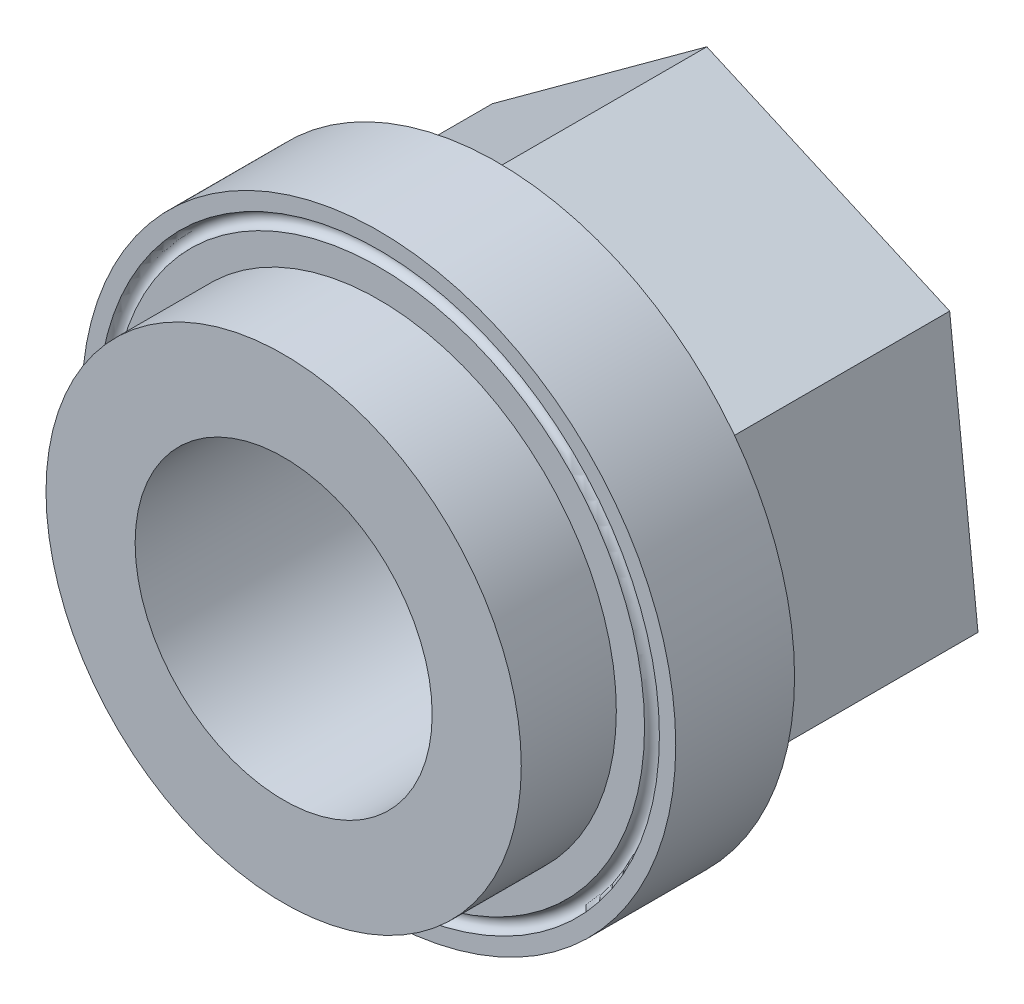
from build123d import *

# Parameters (mm, degrees)
SKETCH2_R            = 25
BOSS_EXTRUDE1_DEPTH  = 10
SKETCH3_R            = 20
BOSS_EXTRUDE2_DEPTH  = 8
BOSS_EXTRUDE3_DEPTH  = 20
SKETCH5_R            = 12.5
CUT_EXTRUDE1_DEPTH   = 52.903757089
CUT_SWEEP1_PROFILE_R = 0.625


with BuildPart() as part:
    # Sketch2 → Boss-Extrude1 (new body)
    with BuildSketch(Plane.XY):
        Circle(SKETCH2_R)
    extrude(amount=BOSS_EXTRUDE1_DEPTH)

    # Sketch3 → Boss-Extrude2 (add)
    with BuildSketch(Plane.XY.offset(10)):
        Circle(SKETCH3_R)
    extrude(amount=BOSS_EXTRUDE2_DEPTH)

    # Sketch4 → Boss-Extrude3 (add)
    with BuildSketch(Plane(origin=(0, 0, 0), x_dir=(-1, 0, 0), z_dir=(0, 0, -1))):
        Polygon((-20.437108974, -9.047000469), (-2.383622252, -22.222555786), (18.053486721, -13.175555316), (20.437108974, 9.047000469), (2.383622252, 22.222555786), (-18.053486721, 13.175555316), align=None)
    extrude(amount=BOSS_EXTRUDE3_DEPTH)

    # Sketch5 → Cut-Extrude1 (cut, through all)
    with BuildSketch(Plane(origin=(0, 0, -20), x_dir=(-1, 0, 0), z_dir=(0, 0, -1))):
        Circle(SKETCH5_R)
    extrude(amount=-CUT_EXTRUDE1_DEPTH, mode=Mode.SUBTRACT)

    # Cut-Sweep1: sweep along a path in Sketch6
    with BuildLine(Plane.XY.offset(10)) as cut_sweep1_path:
        CenterArc((0, 0), 23, 0, 360)
    # Cut-Sweep1 profile (on start of the path) → Cut-Sweep1 (sweep, cut)
    with BuildSketch(Plane(origin=(23, 0, 10), x_dir=(0, 0, 1), z_dir=(0, 1, 0))):
        Circle(CUT_SWEEP1_PROFILE_R)
    sweep(path=cut_sweep1_path.line, mode=Mode.SUBTRACT)


solid = part.part
